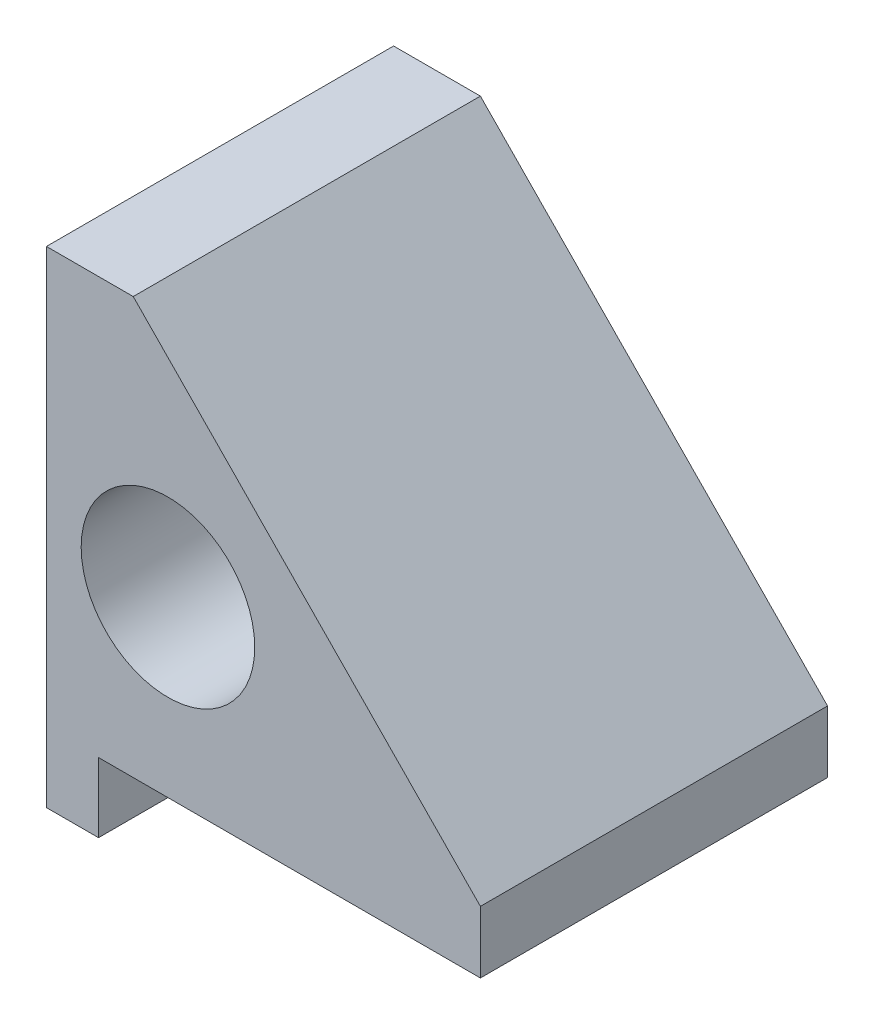
from build123d import *

# Parameters (mm, degrees)
ESQUISSE1_R          = 5
BASE_EXTRUSION_DEPTH = 20


with BuildPart() as part:
    # Esquisse1 → Base-Extrusion (new body)
    with BuildSketch(Plane.XY):
        Polygon((0, 0), (22, 0), (22, 3.574468085), (2, 24), (-3, 24), (-3, -4), (0, -4), align=None)
        with Locations((4, 10)):
            Circle(ESQUISSE1_R, mode=Mode.SUBTRACT)
    extrude(amount=BASE_EXTRUSION_DEPTH)


solid = part.part
